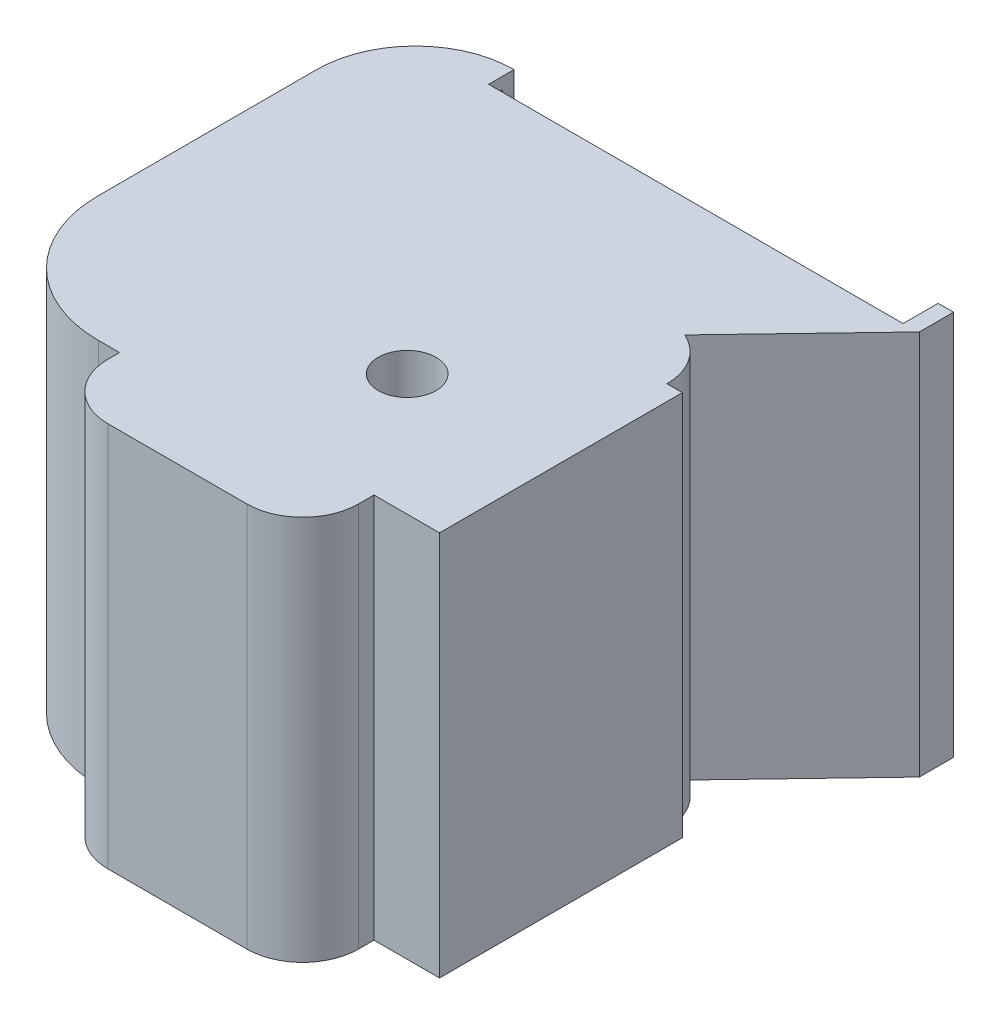
from build123d import *

# Parameters (mm, degrees)
BOSS_EXTRUDE2_DEPTH      = 8.2
BOSS_EXTRUDE2_DEPTH_BACK = 1.5
BOSS_EXTRUDE3_DEPTH      = 0.3
SKETCH7_R                = 0.75
CUT_EXTRUDE2_DEPTH       = 0.3
SKETCH8_R                = 1.1
SKETCH8_R_2              = 0.75
BOSS_EXTRUDE4_DEPTH      = 4.45


with BuildPart() as part:
    # Sketch1 → Boss-Extrude2 (new, two sides: drawn at the far end of the back side and taken through both)
    with BuildSketch(Plane(origin=(0, 0, 0), x_dir=(1, 0, 0), z_dir=(0, 1, 0)).offset(-BOSS_EXTRUDE2_DEPTH_BACK)):
        with BuildLine():
            Line((6.911883639, 6.253618181), (6.911883639, 7.018695497))
            Line((6.911883639, 7.018695497), (7.211883639, 7.018695497))
            Line((7.211883639, 7.018695497), (7.211883639, 6.133248982))
            Line((7.211883639, 6.133248982), (4.236305543, 3.022131406))
            ThreePointArc((4.236305543, 3.022131406), (4.866361255, 2.487299926), (5.101883639, 1.695123103))
            Line((5.101883639, 1.695123103), (5.501883639, 1.695123103))
            Line((5.501883639, 1.695123103), (5.501883639, -4.604876897))
            Line((5.501883639, -4.604876897), (3.801883639, -4.604876897))
            Line((3.801883639, -4.604876897), (3.801883639, -5.004876897))
            ThreePointArc((3.801883639, -5.004876897), (3.377188471, -6.03018173), (2.351883639, -6.454876897))
            Line((2.351883639, -6.454876897), (-1.248116361, -6.454876897))
            ThreePointArc((-1.248116361, -6.454876897), (-2.273421194, -6.03018173), (-2.698116361, -5.004876897))
            Line((-2.698116361, -5.004876897), (-2.698116361, -4.704876897))
            Line((-2.698116361, -4.704876897), (-3.248116361, -4.704876897))
            ThreePointArc((-3.248116361, -4.704876897), (-5.5462134, -3.752973936), (-6.498116361, -1.454876897))
            Line((-6.498116361, -1.454876897), (-6.498116361, 4.208695497))
            ThreePointArc((-6.498116361, 4.208695497), (-5.748309721, 6.018888856), (-3.938116361, 6.768695497))
            Line((-3.938116361, 6.768695497), (-3.938116361, 6.468695497))
            ThreePointArc((-3.938116361, 6.468695497), (-5.536177687, 5.806756822), (-6.198116361, 4.208695497))
            Line((-6.198116361, 4.208695497), (-6.198116361, -1.454876897))
            ThreePointArc((-6.198116361, -1.454876897), (-5.334081366, -3.540841902), (-3.248116361, -4.404876897))
            Line((-3.248116361, -4.404876897), (-2.398116361, -4.404876897))
            Line((-2.398116361, -4.404876897), (-2.398116361, -5.004876897))
            ThreePointArc((-2.398116361, -5.004876897), (-2.06128916, -5.818049696), (-1.248116361, -6.154876897))
            Line((-1.248116361, -6.154876897), (2.351883639, -6.154876897))
            ThreePointArc((2.351883639, -6.154876897), (3.165056437, -5.818049696), (3.501883639, -5.004876897))
            Line((3.501883639, -5.004876897), (3.501883639, -4.304876897))
            Line((3.501883639, -4.304876897), (5.201883639, -4.304876897))
            Line((5.201883639, -4.304876897), (5.201883639, 1.395123103))
            Line((5.201883639, 1.395123103), (4.801883639, 1.395123103))
            Line((4.801883639, 1.395123103), (4.801883639, 1.695123103))
            ThreePointArc((4.801883639, 1.695123103), (4.465056437, 2.508295901), (3.651883639, 2.845123103))
            Line((3.651883639, 2.845123103), (6.911883639, 6.253618181))
        make_face()
    extrude(amount=BOSS_EXTRUDE2_DEPTH + BOSS_EXTRUDE2_DEPTH_BACK)

    # Sketch6 → Boss-Extrude3 (add)
    with BuildSketch(Plane(origin=(0, 8.2, 0), x_dir=(1, 0, 0), z_dir=(0, 1, 0))):
        with BuildLine():
            Line((-3.938116361, 6.768695497), (6.911883639, 7.018695497))
            Line((6.911883639, 7.018695497), (7.211883639, 7.018695497))
            Line((7.211883639, 7.018695497), (7.211883639, 6.133248982))
            Line((7.211883639, 6.133248982), (4.236305543, 3.022131406))
            ThreePointArc((4.236305543, 3.022131406), (4.866361255, 2.487299926), (5.101883639, 1.695123103))
            Line((5.101883639, 1.695123103), (5.501883639, 1.695123103))
            Line((5.501883639, 1.695123103), (5.501883639, -4.604876897))
            Line((5.501883639, -4.604876897), (3.801883639, -4.604876897))
            Line((3.801883639, -4.604876897), (3.801883639, -5.004876897))
            ThreePointArc((3.801883639, -5.004876897), (3.377188471, -6.03018173), (2.351883639, -6.454876897))
            Line((2.351883639, -6.454876897), (-1.248116361, -6.454876897))
            ThreePointArc((-1.248116361, -6.454876897), (-2.273421194, -6.03018173), (-2.698116361, -5.004876897))
            Line((-2.698116361, -5.004876897), (-2.698116361, -4.704876897))
            Line((-2.698116361, -4.704876897), (-3.248116361, -4.704876897))
            ThreePointArc((-3.248116361, -4.704876897), (-5.5462134, -3.752973936), (-6.498116361, -1.454876897))
            Line((-6.498116361, -1.454876897), (-6.498116361, 4.208695497))
            ThreePointArc((-6.498116361, 4.208695497), (-5.748309721, 6.018888856), (-3.938116361, 6.768695497))
        make_face()
    extrude(amount=BOSS_EXTRUDE3_DEPTH)

    # Sketch7 → Cut-Extrude2 (cut)
    with BuildSketch(Plane(origin=(0, 8.5, 0), x_dir=(1, 0, 0), z_dir=(0, 1, 0))):
        with Locations(Location((1.511883639, -1.454876897, 0), (0, 0, 270))):
            Circle(SKETCH7_R)
        Polygon((-3.938116361, 6.768695497), (-3.938116361, 6.108695497), (6.811883639, 6.108695497), (6.811883639, 7.016391349), align=None)
    extrude(amount=-CUT_EXTRUDE2_DEPTH, mode=Mode.SUBTRACT)

    # Sketch8 → Boss-Extrude4 (add)
    with BuildSketch(Plane.XZ.offset(-8.2)):
        with Locations(Location((1.511883639, 1.454876897, 0), (0, 0, 90))):
            Circle(SKETCH8_R)
        with Locations(Location((1.511883639, 1.454876897, 0), (0, 0, 90))):
            Circle(SKETCH8_R_2, mode=Mode.SUBTRACT)
    extrude(amount=BOSS_EXTRUDE4_DEPTH)


solid = part.part
